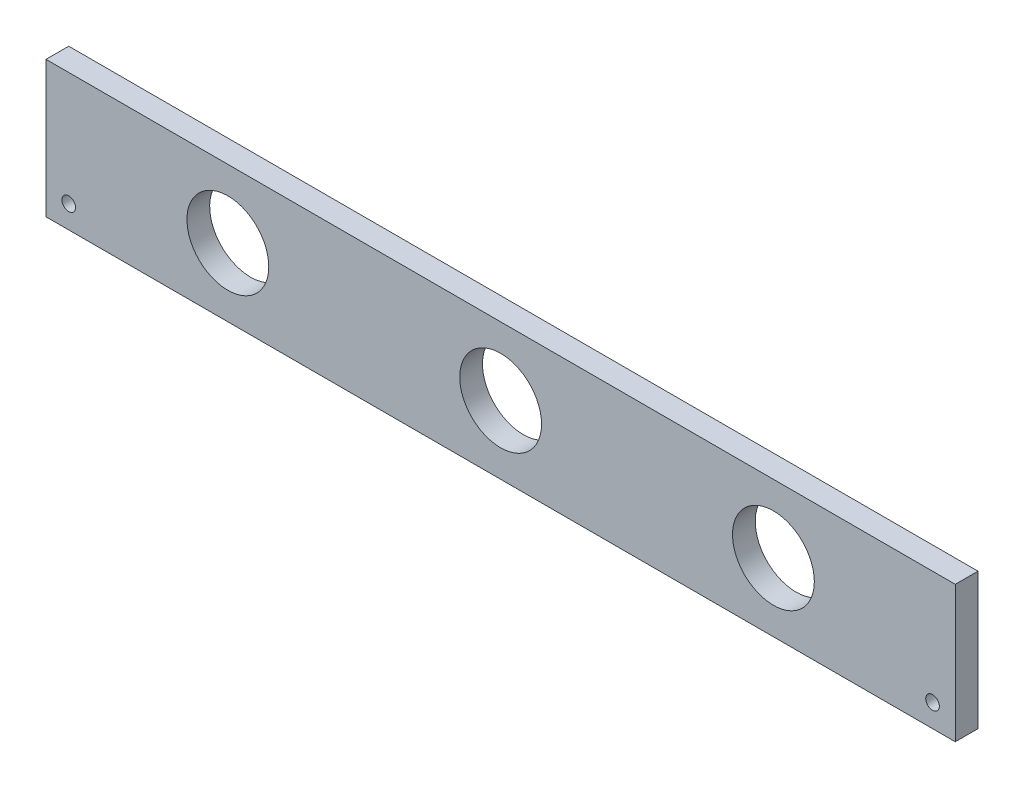
from build123d import *

# Parameters (mm, degrees)
SKETCH1_W           = 5
SKETCH1_H           = 30
BOSS_EXTRUDE1_DEPTH = 100
SKETCH4_R           = 9
SKETCH4_R_2         = 1.5
CUT_EXTRUDE2_DEPTH  = 10


with BuildPart() as part:
    # Sketch1 → Boss-Extrude1 (new, symmetric)
    with BuildSketch(Plane(origin=(0, 0, 0), x_dir=(0, 0, -1), z_dir=(1, 0, 0))):
        with Locations((2.5, 15)):
            Rectangle(SKETCH1_W, SKETCH1_H)
    extrude(amount=BOSS_EXTRUDE1_DEPTH, both=True)

    # Sketch4 → Cut-Extrude2 (cut)
    with BuildSketch(Plane.XY):
        with Locations((0, 15)):
            Circle(SKETCH4_R)
        with Locations((60, 15)):
            Circle(SKETCH4_R)
        with Locations((-60, 15)):
            Circle(SKETCH4_R)
        with Locations((-95, 5)):
            Circle(SKETCH4_R_2)
        with Locations((95, 5)):
            Circle(SKETCH4_R_2)
    extrude(amount=-CUT_EXTRUDE2_DEPTH, mode=Mode.SUBTRACT)


solid = part.part
